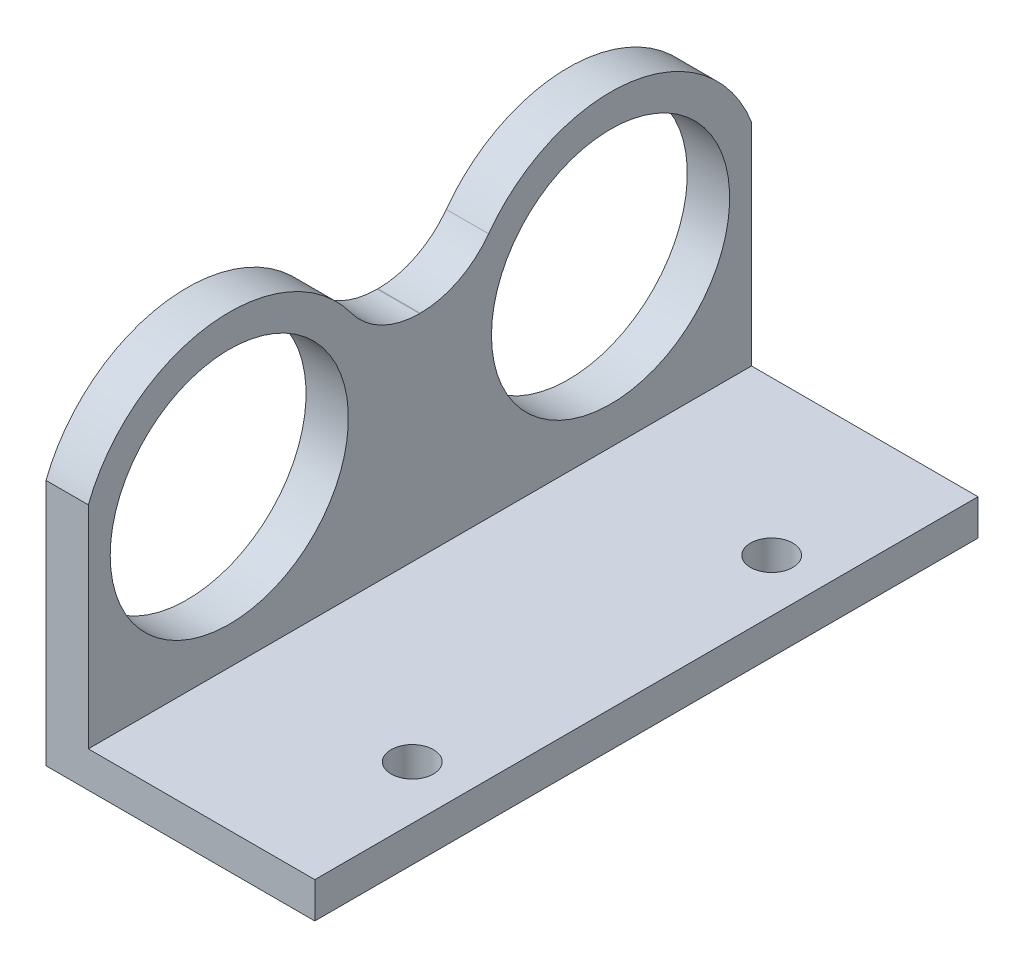
from build123d import *

# Parameters (mm, degrees)
SKETCH1_W           = 19.05
SKETCH1_H           = 47
BOSS_EXTRUDE1_DEPTH = 2.54
SKETCH2_R           = 8.44
BOSS_EXTRUDE2_DEPTH = 3
SKETCH3_R           = 1.5
CUT_EXTRUDE1_DEPTH  = 56.204627156


with BuildPart() as part:
    # Sketch1 → Boss-Extrude1 (new body)
    with BuildSketch(Plane(origin=(0, 0, 0), x_dir=(1, 0, 0), z_dir=(0, 1, 0))):
        with Locations((9.525, 23.5)):
            Rectangle(SKETCH1_W, SKETCH1_H)
    extrude(amount=BOSS_EXTRUDE1_DEPTH)

    # Sketch2 → Boss-Extrude2 (add)
    with BuildSketch(Plane.ZY):
        with BuildLine():
            Line((-23.526869674, 17.516472082), (-23.473130326, 17.516472082))
            ThreePointArc((-23.473130326, 17.516472082), (-20.760886981, 18.164487773), (-18.634502385, 19.968560069))
            ThreePointArc((-18.634502385, 19.968560069), (-8.591509803, 24.257746253), (0, 17.516472082))
            Line((0, 17.516472082), (0, 2.54))
            Line((0, 2.54), (-47, 2.54))
            Line((-47, 2.54), (-47, 17.516472082))
            ThreePointArc((-47, 17.516472082), (-38.408490197, 24.257746253), (-28.365497615, 19.968560069))
            ThreePointArc((-28.365497615, 19.968560069), (-26.239113019, 18.164487773), (-23.526869674, 17.516472082))
        make_face()
        with Locations((-9.99, 13.63)):
            Circle(SKETCH2_R, mode=Mode.SUBTRACT)
        with Locations((-37.01, 13.63)):
            Circle(SKETCH2_R, mode=Mode.SUBTRACT)
    extrude(amount=-BOSS_EXTRUDE2_DEPTH)

    # Sketch3 → Cut-Extrude1 (cut, through all)
    with BuildSketch(Plane(origin=(0, 2.54, 0), x_dir=(1, 0, 0), z_dir=(0, 1, 0))):
        with Locations(Location((15.274497475, 10.68388452, 0), (0, 0, 270))):
            Circle(SKETCH3_R)
        with Locations(Location((15.33, 36.095973984, 0), (0, 0, 270))):
            Circle(SKETCH3_R)
    extrude(amount=-CUT_EXTRUDE1_DEPTH, mode=Mode.SUBTRACT)


solid = part.part
